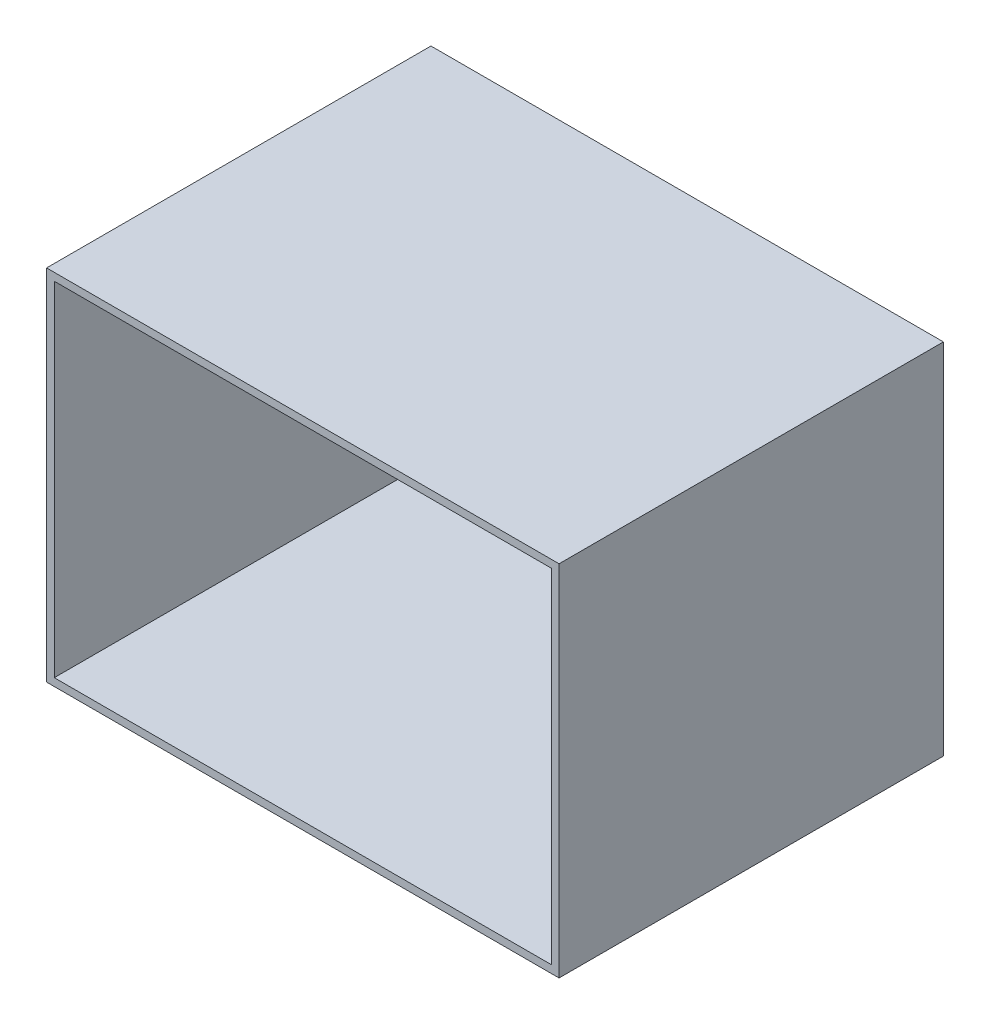
from build123d import *

# Parameters (mm, degrees)
CROQUIS1_W              = 200
CROQUIS1_H              = 150
SALIENTE_EXTRUIR1_DEPTH = 3
CROQUIS2_W              = 3
CROQUIS2_H              = 150
SALIENTE_EXTRUIR2_DEPTH = 134
CROQUIS3_W              = 200
CROQUIS3_H              = 150
SALIENTE_EXTRUIR3_DEPTH = 3


with BuildPart() as part:
    # Croquis1 → Saliente-Extruir1 (new body)
    with BuildSketch(Plane(origin=(0, 0, 0), x_dir=(1, 0, 0), z_dir=(0, 1, 0))):
        with Locations((100, 75)):
            Rectangle(CROQUIS1_W, CROQUIS1_H)
    extrude(amount=SALIENTE_EXTRUIR1_DEPTH)

    # Croquis2 → Saliente-Extruir2 (add)
    with BuildSketch(Plane(origin=(0, 3, 0), x_dir=(1, 0, 0), z_dir=(0, 1, 0))):
        with Locations((1.5, 75)):
            Rectangle(CROQUIS2_W, CROQUIS2_H)
        with Locations((198.5, 75)):
            Rectangle(CROQUIS2_W, CROQUIS2_H)
    extrude(amount=SALIENTE_EXTRUIR2_DEPTH)

    # Croquis3 → Saliente-Extruir3 (add)
    with BuildSketch(Plane(origin=(0, 137, 0), x_dir=(1, 0, 0), z_dir=(0, 1, 0))):
        with Locations((100, 75)):
            Rectangle(CROQUIS3_W, CROQUIS3_H)
    extrude(amount=SALIENTE_EXTRUIR3_DEPTH)


solid = part.part
